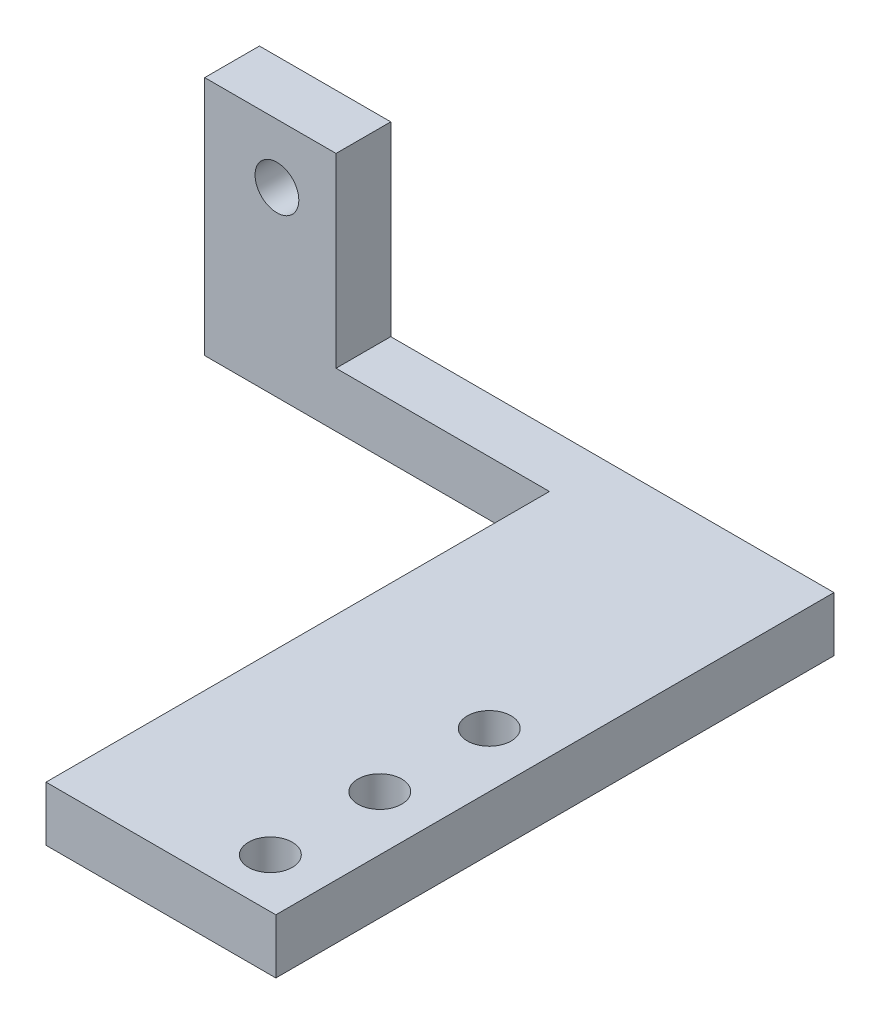
from build123d import *

# Parameters (mm, degrees)
SALIENTE_EXTRUIR1_DEPTH = 5
CROQUIS2_W              = 12
CROQUIS2_H              = 5
SALIENTE_EXTRUIR2_DEPTH = 17
CROQUIS3_R              = 2
CORTAR_EXTRUIR1_DEPTH   = 20
CROQUIS4_R              = 2
CORTAR_EXTRUIR2_DEPTH   = 20


with BuildPart() as part:
    # Croquis1 → Saliente-Extruir1 (new body)
    with BuildSketch(Plane(origin=(0, 0, 0), x_dir=(1, 0, 0), z_dir=(0, 1, 0))):
        Polygon((10.696721311, 25.149180328), (-5.350819672, 25.149180328), (-41.803278689, 25.149180328), (-41.803278689, 20.149180328), (-10.303278689, 20.149180328), (-10.303278689, -25.850819672), (10.696721311, -25.850819672), align=None)
    extrude(amount=SALIENTE_EXTRUIR1_DEPTH)

    # Croquis2 → Saliente-Extruir2 (add)
    with BuildSketch(Plane(origin=(0, 5, 0), x_dir=(1, 0, 0), z_dir=(0, 1, 0))):
        with Locations((-35.803278689, 22.649180328)):
            Rectangle(CROQUIS2_W, CROQUIS2_H)
    extrude(amount=SALIENTE_EXTRUIR2_DEPTH)

    # Croquis3 → Cortar-Extruir1 (cut)
    with BuildSketch(Plane.XZ):
        with Locations(Location((5.696721311, 21.350819672, 0), (0, 0, 270))):
            Circle(CROQUIS3_R)
        with Locations(Location((5.696721311, 11.350819672, 0), (0, 0, 270))):
            Circle(CROQUIS3_R)
        with Locations(Location((5.696721311, 1.350819672, 0), (0, 0, 270))):
            Circle(CROQUIS3_R)
    extrude(amount=-CORTAR_EXTRUIR1_DEPTH, mode=Mode.SUBTRACT)

    # Croquis4 → Cortar-Extruir2 (cut)
    with BuildSketch(Plane.XY.offset(-20.149180328)):
        with Locations((-35.203278689, 16.6)):
            Circle(CROQUIS4_R)
    extrude(amount=-CORTAR_EXTRUIR2_DEPTH, mode=Mode.SUBTRACT)


solid = part.part
